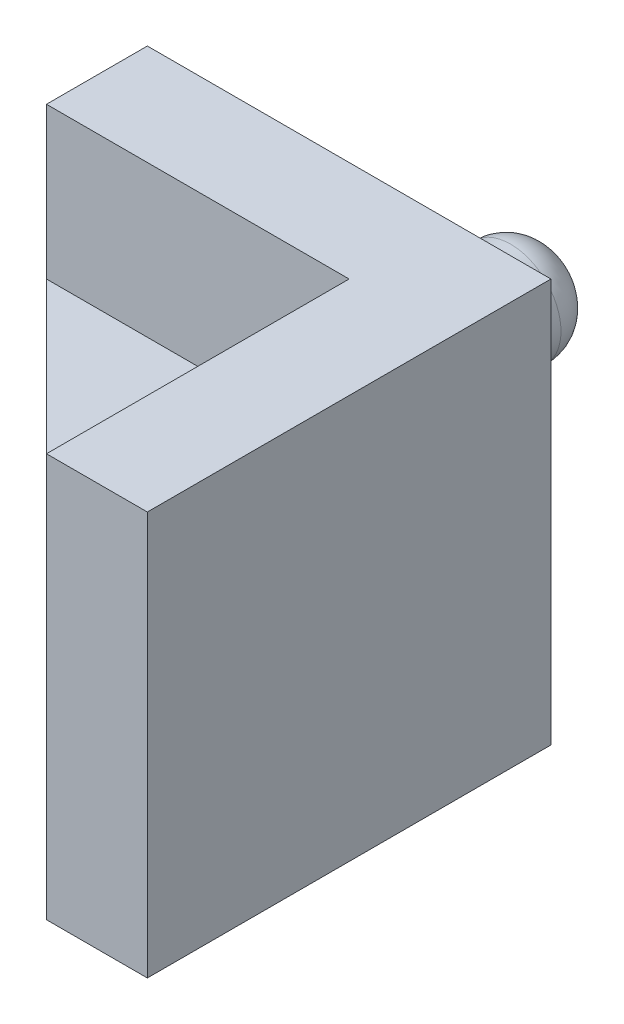
from build123d import *

# Parameters (mm, degrees)
BOSS_EXTRUDE1_DEPTH = 10
SKETCH3_R           = 2.5
BOSS_EXTRUDE2_DEPTH = 10
FILLET1_R           = 2
RIB14_REACH         = 37
SKETCH5_WALL_W      = 93.213203436
SKETCH5_WALL_H      = 5


with BuildPart() as part:
    # Sketch2 → Boss-Extrude1 (new, symmetric)
    with BuildSketch(Plane(origin=(0, 0, 0), x_dir=(1, 0, 0), z_dir=(0, 1, 0))):
        Polygon((0, 15), (-15, 15), (-15, 20), (5, 20), (5, 0), (0, 0), align=None)
    extrude(amount=BOSS_EXTRUDE1_DEPTH, both=True)

    # Sketch3 → Boss-Extrude2 (add)
    with BuildSketch(Plane(origin=(0, 0, -20), x_dir=(-1, 0, 0), z_dir=(0, 0, -1))):
        with Locations((5, 0)):
            Circle(SKETCH3_R)
    extrude(amount=BOSS_EXTRUDE2_DEPTH)

    # Fillet1
    fillet1_edges = [part.edges().sort_by_distance(p)[0] for p in [
        (-2.5, 0, -30),
    ]]
    fillet(fillet1_edges, radius=FILLET1_R)

    # Sketch5 wall → Rib14 (add, up to next)
    with BuildSketch(Plane(origin=(-7.5, 0, -7.5), x_dir=(0.707106781187, 0, 0.707106781187), z_dir=(0.707106781187, 0, -0.707106781187)), mode=Mode.PRIVATE) as rib14_sk1:
        Rectangle(SKETCH5_WALL_W, SKETCH5_WALL_H)
    rib14_tool1 = extrude(rib14_sk1.sketch, amount=RIB14_REACH, mode=Mode.PRIVATE) - part.part
    add(rib14_tool1.solids().sort_by_distance((-7.5, 0, -7.5))[0])


solid = part.part
